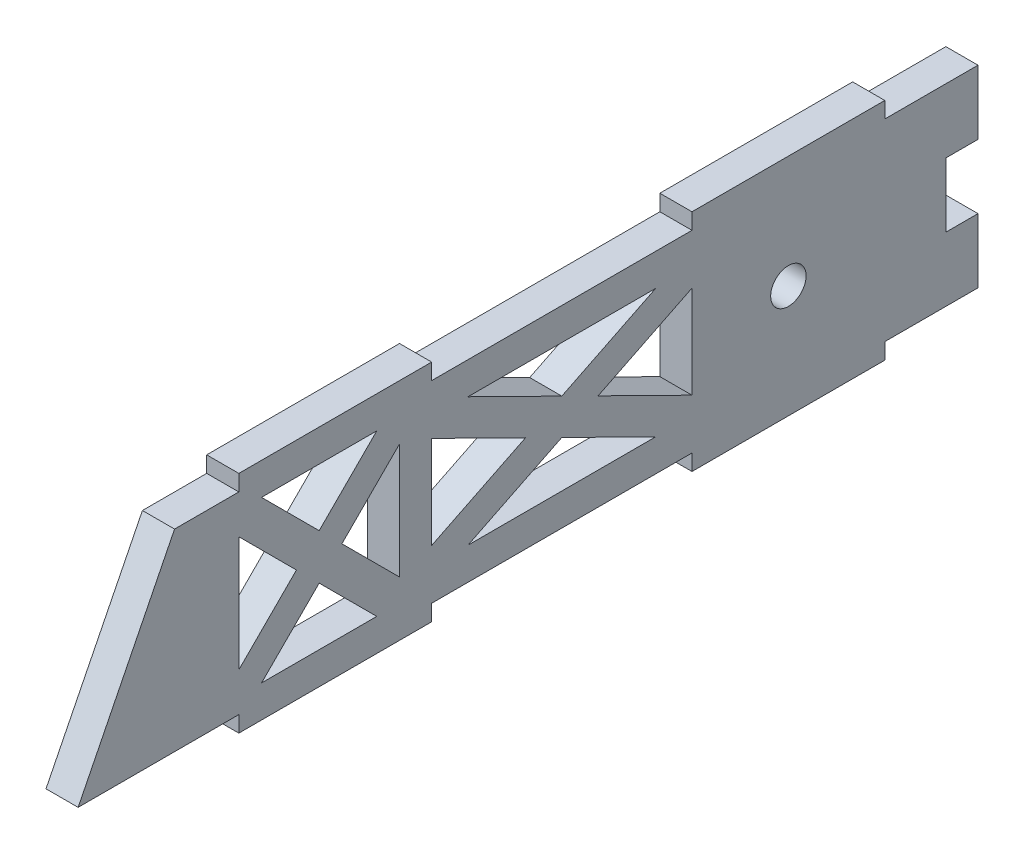
from build123d import *

# Parameters (mm, degrees)
SKETCH1_W               = 355.6
SKETCH1_H               = 76.2
BOSS_EXTRUDE1_DEPTH     = 12.7
CUT_EXTRUDE1_DEPTH      = 183.279291199
CUT_EXTRUDE1_DEPTH_BACK = 183.279291199
SKETCH3_W               = 76.2
SKETCH3_H               = 6.35
BOSS_EXTRUDE2_DEPTH     = 12.7
SKETCH4_W               = 12.7
SKETCH4_H               = 25.4
CUT_EXTRUDE2_DEPTH      = 184.711546997
SKETCH5_R               = 7
CUT_EXTRUDE3_DEPTH      = 184.711546997
CUT_EXTRUDE4_DEPTH      = 184.711546997


with BuildPart() as part:
    # Sketch1 → Boss-Extrude1 (new body)
    with BuildSketch(Plane(origin=(0, 0, 0), x_dir=(0, 0, -1), z_dir=(1, 0, 0))):
        Rectangle(SKETCH1_W, SKETCH1_H)
    extrude(amount=BOSS_EXTRUDE1_DEPTH)

    # Sketch2 → Cut-Extrude1 (cut, two sides: drawn at the far end of the back side and taken through both)
    with BuildSketch(Plane(origin=(12.7, 0, 0), x_dir=(0, 0, -1), z_dir=(1, 0, 0)).offset(-CUT_EXTRUDE1_DEPTH_BACK)):
        Polygon((-507.550847217, -697.601694433), (-177.8, -38.1), (-139.7, 38.1), (190.050847217, 697.601694433), (-1128.95254165, 1357.103388866), (-1826.554236083, -38.1), align=None)
    extrude(amount=CUT_EXTRUDE1_DEPTH + CUT_EXTRUDE1_DEPTH_BACK, mode=Mode.SUBTRACT)

    # Sketch3 → Boss-Extrude2 (add)
    with BuildSketch(Plane.ZY):
        with Locations((-102.87, -41.275)):
            Rectangle(SKETCH3_W, SKETCH3_H)
        with Locations((76.2, -41.275)):
            Rectangle(SKETCH3_W, SKETCH3_H)
        with Locations((-102.87, 41.275)):
            Rectangle(SKETCH3_W, SKETCH3_H)
        with Locations((76.2, 41.275)):
            Rectangle(SKETCH3_W, SKETCH3_H)
    extrude(amount=-BOSS_EXTRUDE2_DEPTH)

    # Sketch4 → Cut-Extrude2 (cut, through all)
    with BuildSketch(Plane.ZY):
        with Locations((-171.45, 0)):
            Rectangle(SKETCH4_W, SKETCH4_H)
    extrude(amount=-CUT_EXTRUDE2_DEPTH, mode=Mode.SUBTRACT)

    # Sketch5 → Cut-Extrude3 (cut, through all)
    with BuildSketch(Plane.ZY):
        with Locations((-102.87, 0)):
            Circle(SKETCH5_R)
    extrude(amount=-CUT_EXTRUDE3_DEPTH, mode=Mode.SUBTRACT)

    # Sketch6 → Cut-Extrude4 (cut, through all)
    with BuildSketch(Plane.ZY):
        Polygon((-13.335, -7.08207294), (-50.428802297, -25.4), (23.758802297, -25.4), align=None)
        Polygon((-27.676197703, 0), (-64.77, 18.31792706), (-64.77, -18.31792706), align=None)
        Polygon((23.758802297, 25.4), (-50.428802297, 25.4), (-13.335, 7.08207294), align=None)
        Polygon((38.1, -18.31792706), (38.1, 18.31792706), (1.006197703, 0), align=None)
        Polygon((105.319743879, -31.75), (82.55, -8.980256121), (59.780256121, -31.75), align=None)
        Polygon((114.3, 22.769743879), (91.530256121, 0), (114.3, -22.769743879), align=None)
        Polygon((73.569743879, 0), (50.8, 22.769743879), (50.8, -22.769743879), align=None)
        Polygon((105.319743879, 31.75), (59.780256121, 31.75), (82.55, 8.980256121), align=None)
    extrude(amount=-CUT_EXTRUDE4_DEPTH, mode=Mode.SUBTRACT)


solid = part.part
